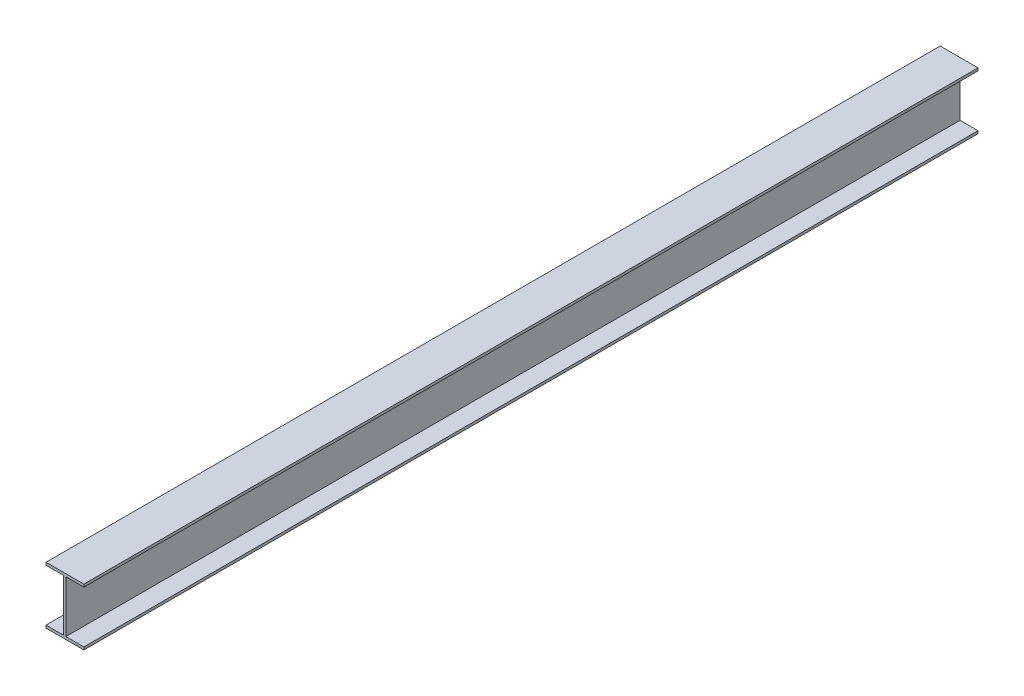
from build123d import *

# Parameters (mm, degrees)
BOSS_EXTRUDE1_DEPTH = 2400


with BuildPart() as part:
    # Sketch1 → Boss-Extrude1 (new body)
    with BuildSketch(Plane.XY):
        Polygon((0, -0.000240533), (101.6, -0.000240533), (101.6, -7.112240533), (53.408035714, -7.112240533), (53.408035714, -146.050240533), (101.6, -146.050240533), (101.6, -153.162240533), (0, -153.162240533), (0, -146.050240533), (47.566035714, -146.050240533), (47.566035714, -7.112240533), (0, -7.112240533), align=None)
    extrude(amount=BOSS_EXTRUDE1_DEPTH)


solid = part.part
